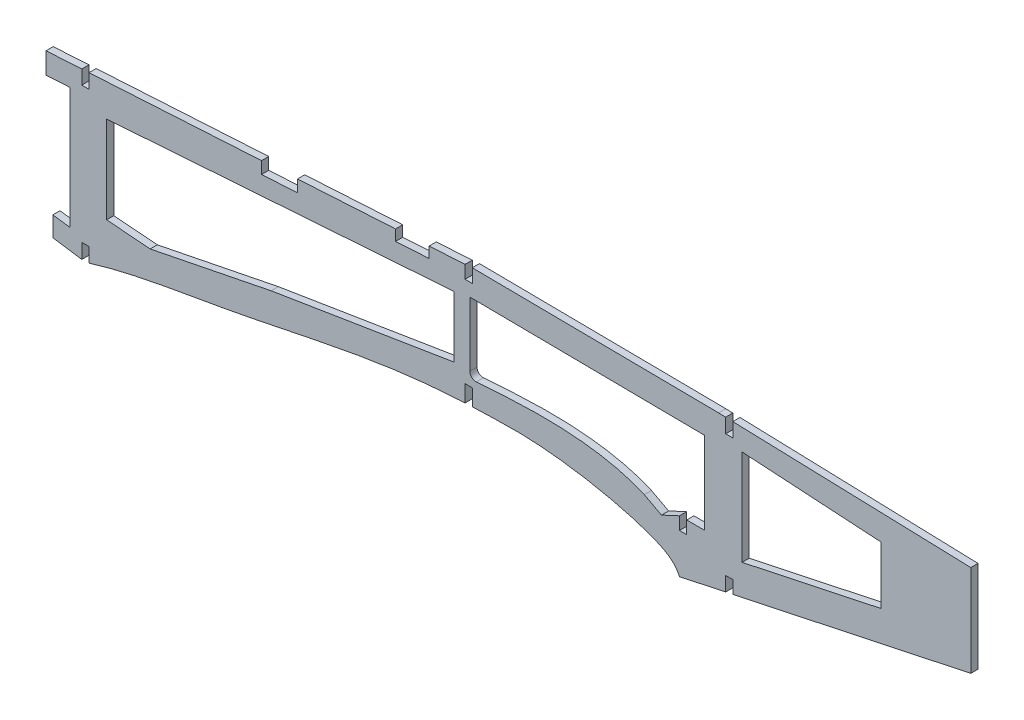
from build123d import *

# Parameters (mm, degrees)
BOSS_EXTRUDE2_DEPTH = 3


with BuildPart() as part:
    # Sketch6 → Boss-Extrude2 (new body)
    with BuildSketch(Plane(origin=(0, 0, -3), x_dir=(-1, 0, 0), z_dir=(0, 0, -1))):
        with BuildLine():
            Line((-19.25, 3.741713812), (0, -0.35))
            add(Edge.make_bspline(
                [(0, -0.35), (3.178862469, 6.495343287), (8.987756305, 8.032168144), (22.140633739, 13.071207305), (43.250433247, 17.69324185), (66.39602757, 18.219905629)],
                knots=[0, 0, 0, 0, 0, 0, 1, 1, 1, 1, 1, 1], degree=5))
            add(Edge.make_bspline(
                [(66.39602757, 18.219905629), (73.079858249, 18.217137873), (79.768873399, 18.101745103), (86.45, 17.815976098)],
                knots=[0.875945967, 0.875945967, 0.875945967, 0.875945967, 0.985673704, 0.985673704, 0.985673704, 0.985673704], degree=3))
            Line((86.45, 17.815976098), (86.45, 24.670250599))
            Line((86.45, 24.670250599), (89.45, 24.670250599))
            Line((89.45, 24.670250599), (89.45, 17.675984992))
            add(Edge.make_bspline(
                [(89.45, 17.675984992), (90.320899947, 17.631898595), (91.191632468, 17.584767892), (92.062168571, 17.534464817)],
                knots=[1.002100386, 1.002100386, 1.002100386, 1.002100386, 1.01640933, 1.01640933, 1.01640933, 1.01640933], degree=3))
            add(Edge.make_bspline(
                [(92.062168571, 17.534464817), (95.665977641, 17.334138157), (108.464938821, 16.428798519), (140.620964858, 12.117510077), (188.052718325, 1.033122833), (227.303556849, -4.3666315), (246.35, -10.231818509)],
                knots=[0, 0, 0, 0, 0.05922822, 0.210539222, 0.531730365, 0.858409316, 0.858409316, 0.858409316, 0.858409316], degree=3))
            Line((246.35, -10.231818509), (246.35, -4.231818509))
            Line((246.35, -4.231818509), (249.35, -4.231818509))
            Line((249.35, -4.231818509), (249.35, -10.422260297))
            Line((249.35, -10.422260297), (261.434958207, -8.613902826))
            Line((261.434958207, -8.613902826), (261.434958207, -0.35))
            Line((261.434958207, -0.35), (254.27, -1.277143049))
            Line((254.27, -1.277143049), (254.27, 49.289954404))
            Line((254.27, 49.289954404), (264.27, 48.703684462))
            Line((264.27, 48.703684462), (264.27, 57.518794836))
            Line((264.27, 57.518794836), (254.27, 58.105064779))
            Line((254.27, 58.105064779), (249.35, 58.39350959))
            Line((249.35, 58.39350959), (249.35, 52.569390573))
            Line((249.35, 52.569390573), (246.35, 52.569390573))
            Line((246.35, 52.569390573), (246.35, 58.569390573))
            Line((246.35, 58.569390573), (174.35, 62.790534157))
            Line((174.35, 62.790534157), (174.35, 57.781948717))
            Line((174.35, 57.781948717), (159.35, 58.66135363))
            Line((159.35, 58.66135363), (159.35, 63.66993907))
            Line((159.35, 63.66993907), (118.45, 66.067783134))
            Line((118.45, 66.067783134), (118.45, 61.560056238))
            Line((118.45, 61.560056238), (104.45, 62.380834157))
            Line((104.45, 62.380834157), (104.45, 66.888561053))
            Line((104.45, 66.888561053), (89.45, 67.767965967))
            Line((89.45, 67.767965967), (89.45, 62.370250599))
            Line((89.45, 62.370250599), (86.45, 62.370250599))
            Line((86.45, 62.370250599), (86.45, 68.043292799))
            Line((86.45, 68.043292799), (-16.333378442, 66.994986377))
            Line((-16.333378442, 66.994986377), (-19.25, 66.904044127))
            Line((-19.25, 66.904044127), (-19.25, 60.904044127))
            Line((-19.25, 60.904044127), (-22.25, 60.904044127))
            Line((-22.25, 60.904044127), (-22.25, 66.810502081))
            Line((-22.25, 66.810502081), (-111.531056313, 64.026657849))
            Line((-111.531056313, 64.026657849), (-121.52619868, 63.715002493))
            Line((-121.52619868, 63.715002493), (-121.52619868, 25.481190944))
            Line((-121.52619868, 25.481190944), (-111.531056313, 23.356657849))
            Line((-111.531056313, 23.356657849), (-22.25, 4.379383497))
            Line((-22.25, 4.379383497), (-22.25, 9.741713812))
            Line((-22.25, 9.741713812), (-19.25, 9.741713812))
            Line((-19.25, 9.741713812), (-19.25, 3.741713812))
        make_face()
        Polygon((-84.1, 54.203030213), (-26.1, 57.75847956), (-26.1, 17.874749636), (-84.1, 30.203030213), align=None, mode=Mode.SUBTRACT)
        with BuildLine():
            Line((-10.5, 21.65), (-10.5, 55.95))
            Line((-10.5, 55.95), (87.47, 56.949213898))
            Line((87.47, 56.949213898), (87.47, 30.129694509))
            ThreePointArc((87.47, 30.129694509), (86.67270256, 28.299174366), (84.789356805, 27.636229443))
            add(Edge.make_bspline(
                [(14.701665666, 21.959575817), (21.19900444, 24.808951329), (34.471850374, 27.925627057), (54.295468051, 29.219545771), (70.832055402, 28.62299092), (81.026620283, 27.908827105), (84.789356805, 27.636229443)],
                knots=[0.099500985, 0.099500985, 0.099500985, 0.099500985, 0.360279093, 0.592189537, 0.828480504, 0.96707438, 0.96707438, 0.96707438, 0.96707438], degree=3))
            Line((14.701665666, 21.959575817), (7.522354632, 18.142268428))
            Line((7.522354632, 18.142268428), (0, 21.65))
            Line((0, 21.65), (0, 16.35))
            Line((0, 16.35), (-3, 16.35))
            Line((-3, 16.35), (-3, 21.65))
            Line((-3, 21.65), (-10.5, 21.65))
        make_face(mode=Mode.SUBTRACT)
        Polygon((93.97, 30.170250599), (93.97, 55.670250599), (238.97, 45.483901662), (238.97, 9.104044127), (220.823057098, 7.643571), (170.32923345, 17.7710139), align=None, mode=Mode.SUBTRACT)
    extrude(amount=BOSS_EXTRUDE2_DEPTH)


solid = part.part
